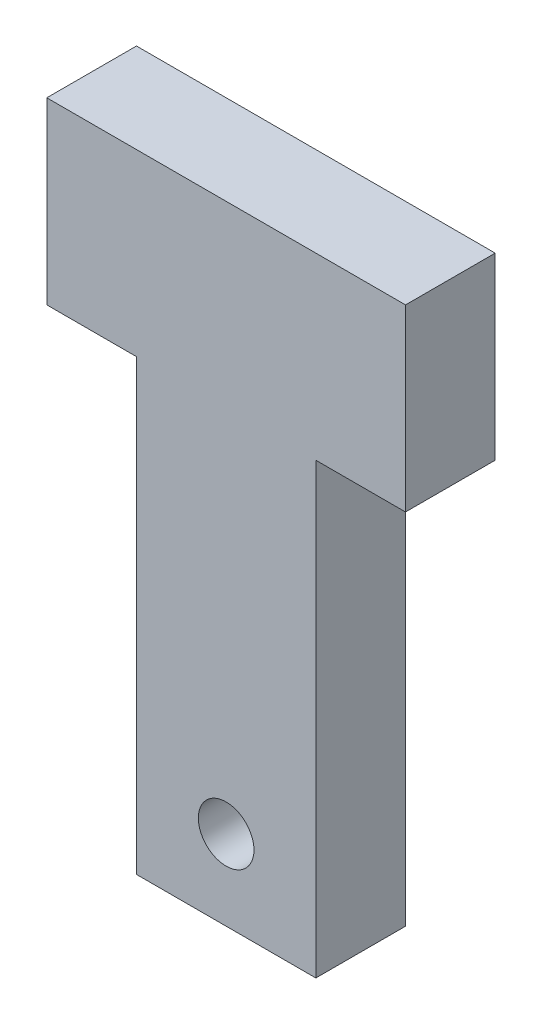
from build123d import *

# Parameters (mm, degrees)
SKETCH_1_R      = 1.55
EXTRUDE_1_DEPTH = 5


with BuildPart() as part:
    # 草圖1 → 填料-伸長1 (new body)
    with BuildSketch(Plane.XY):
        Polygon((-5, -5), (-10, -5), (-10, 5), (10, 5), (10, -5), (5, -5), (5, -30), (-5, -30), align=None)
        with Locations((0, -25.55)):
            Circle(SKETCH_1_R, mode=Mode.SUBTRACT)
    extrude(amount=EXTRUDE_1_DEPTH)


solid = part.part
